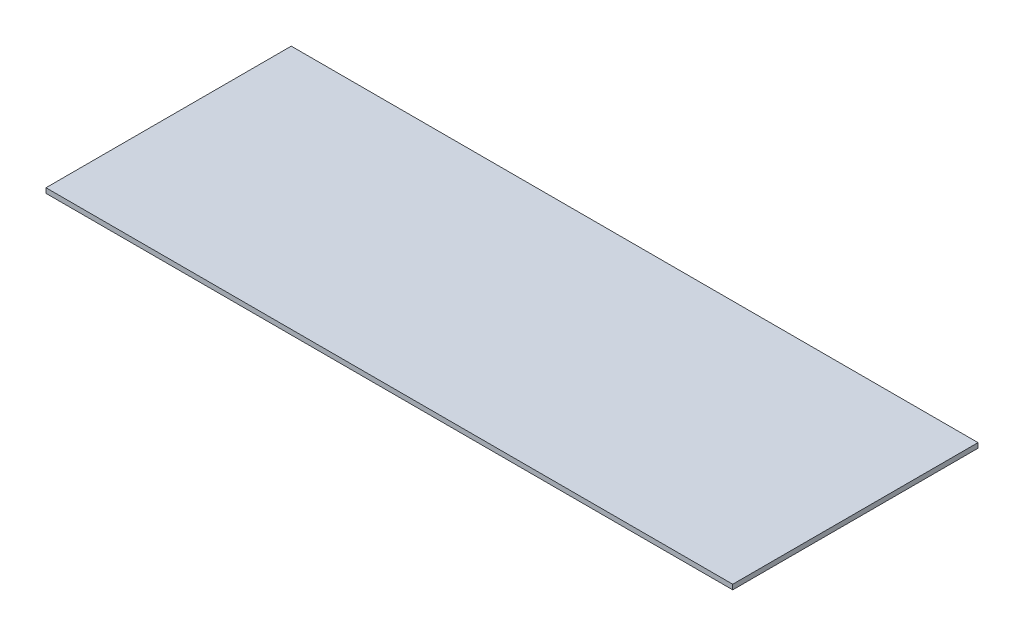
from build123d import *

# Parameters (mm, degrees)
CROQUIS1_W              = 1400
CROQUIS1_H              = 500
SALIENTE_EXTRUIR1_DEPTH = 10


with BuildPart() as part:
    # Croquis1 → Saliente-Extruir1 (new body)
    with BuildSketch(Plane(origin=(0, 0, 0), x_dir=(1, 0, 0), z_dir=(0, 1, 0))):
        Rectangle(CROQUIS1_W, CROQUIS1_H)
    extrude(amount=SALIENTE_EXTRUIR1_DEPTH)


solid = part.part
